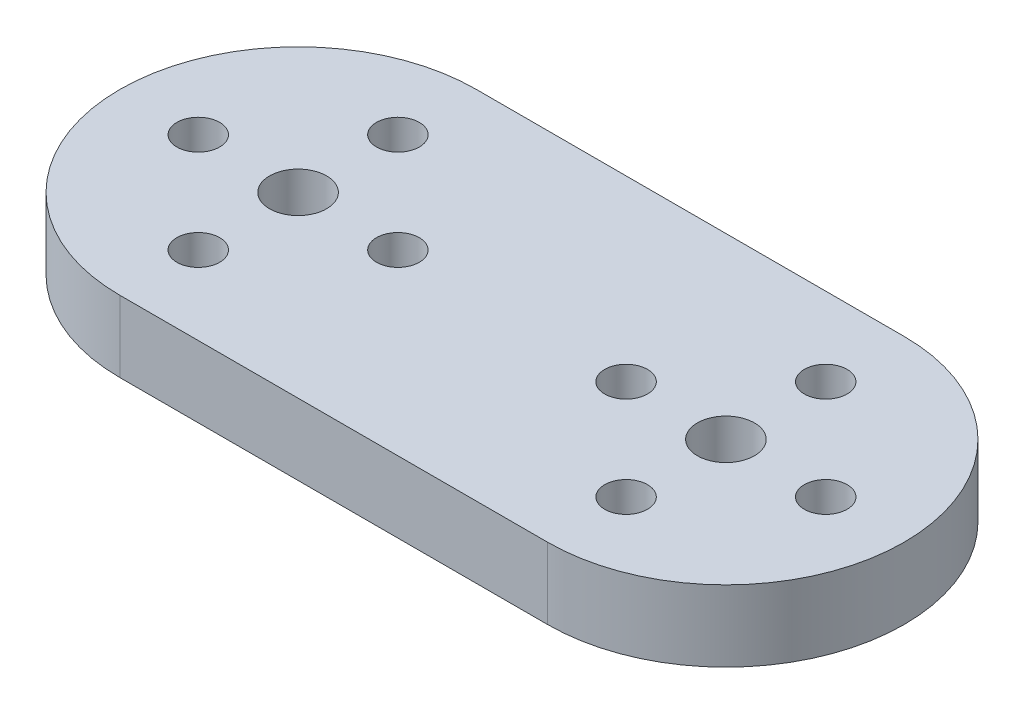
from build123d import *

# Parameters (mm, degrees)
SKETCH_1_R      = 2
SKETCH_1_R_2    = 1.5
EXTRUDE_1_DEPTH = 5


with BuildPart() as part:
    # 草图1 → 凸台-拉伸1 (new body)
    with BuildSketch(Plane(origin=(0, 0, 0), x_dir=(1, 0, 0), z_dir=(0, 1, 0))):
        with BuildLine():
            Line((0, 12.5), (30, 12.5))
            ThreePointArc((30, 12.5), (42.5, 0), (30, -12.5))
            Line((30, -12.5), (0, -12.5))
            ThreePointArc((0, -12.5), (-12.5, 0), (0, 12.5))
        make_face()
        with Locations(Location((30, 0, 0), (0, 0, 270))):
            Circle(SKETCH_1_R, mode=Mode.SUBTRACT)
        with Locations(Location((0, 0, 0), (0, 0, 270))):
            Circle(SKETCH_1_R, mode=Mode.SUBTRACT)
        with Locations(Location((7, 0, 0), (0, 0, 270))):
            Circle(SKETCH_1_R_2, mode=Mode.SUBTRACT)
        with Locations(Location((0, 7, 0), (0, 0, 270))):
            Circle(SKETCH_1_R_2, mode=Mode.SUBTRACT)
        with Locations(Location((-7, 0, 0), (0, 0, 270))):
            Circle(SKETCH_1_R_2, mode=Mode.SUBTRACT)
        with Locations(Location((0, -7, 0), (0, 0, 270))):
            Circle(SKETCH_1_R_2, mode=Mode.SUBTRACT)
        with Locations(Location((23, 0, 0), (0, 0, 90))):
            Circle(SKETCH_1_R_2, mode=Mode.SUBTRACT)
        with Locations(Location((30, -7, 0), (0, 0, 90))):
            Circle(SKETCH_1_R_2, mode=Mode.SUBTRACT)
        with Locations(Location((37, 0, 0), (0, 0, 90))):
            Circle(SKETCH_1_R_2, mode=Mode.SUBTRACT)
        with Locations(Location((30, 7, 0), (0, 0, 90))):
            Circle(SKETCH_1_R_2, mode=Mode.SUBTRACT)
    extrude(amount=EXTRUDE_1_DEPTH)


solid = part.part
